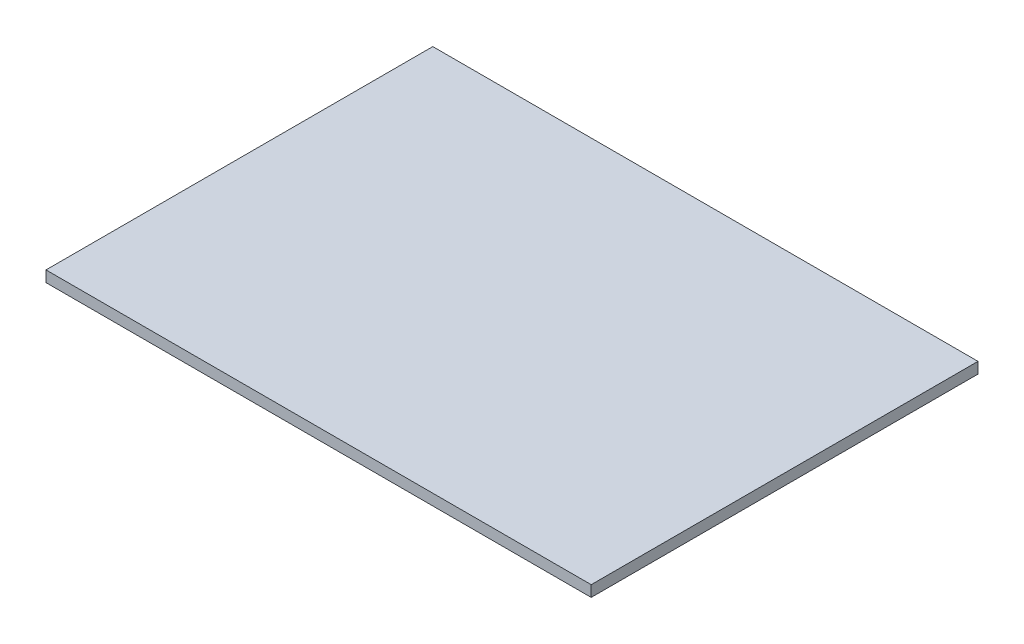
from build123d import *

# Parameters (mm, degrees)
SKETCH_1_W      = 148
SKETCH_1_H      = 105
EXTRUDE_1_DEPTH = 3


with BuildPart() as part:
    # 스케치1 → 보스-돌출1 (new body)
    with BuildSketch(Plane(origin=(0, 0, 0), x_dir=(1, 0, 0), z_dir=(0, 1, 0))):
        with Locations((74, 52.5)):
            Rectangle(SKETCH_1_W, SKETCH_1_H)
    extrude(amount=EXTRUDE_1_DEPTH)


solid = part.part
